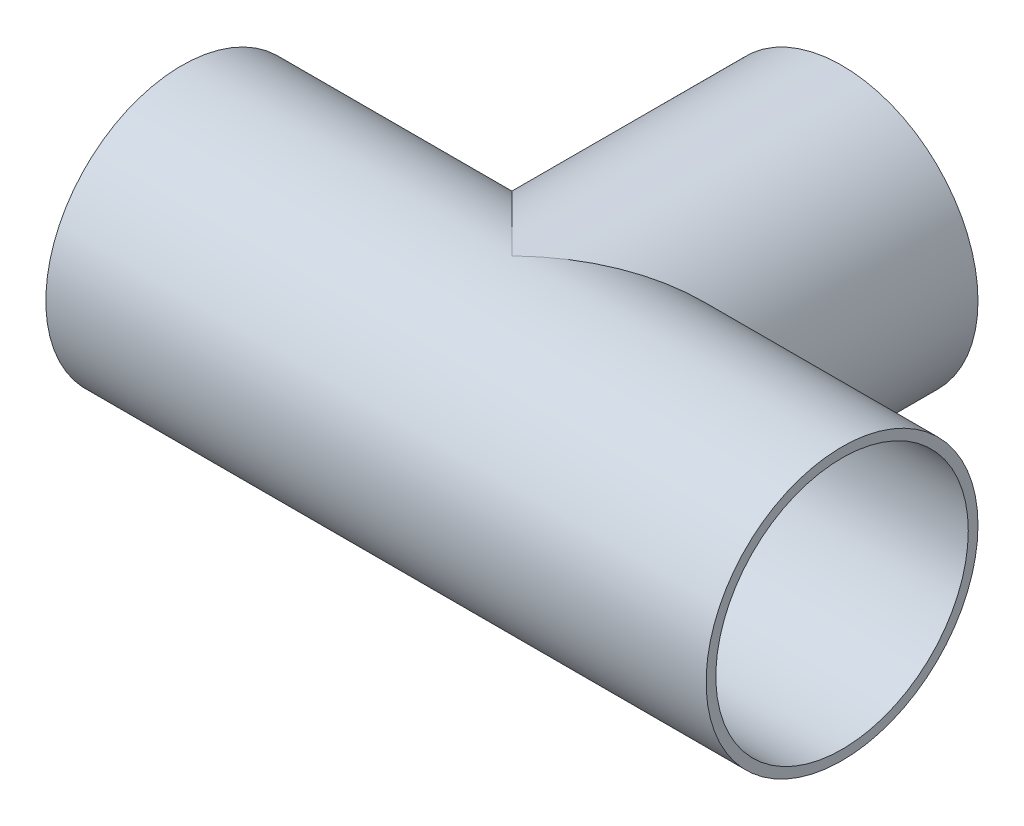
from build123d import *

# Parameters (mm, degrees)
SKETCH1_R           = 35
BOSS_EXTRUDE1_DEPTH = 170
SKETCH4_R           = 35
BOSS_EXTRUDE2_DEPTH = 85
SKETCH5_R           = 32.5
CUT_EXTRUDE2_DEPTH  = 85
SKETCH2_R           = 32.5
CUT_EXTRUDE3_DEPTH  = 194.261480901


with BuildPart() as part:
    # Sketch1 → Boss-Extrude1 (new body)
    with BuildSketch(Plane(origin=(0, 0, 0), x_dir=(0, 0, -1), z_dir=(1, 0, 0))):
        Circle(SKETCH1_R)
    extrude(amount=-BOSS_EXTRUDE1_DEPTH)

    # Sketch4 → Boss-Extrude2 (add)
    with BuildSketch(Plane.XY):
        with Locations((-85, 0)):
            Circle(SKETCH4_R)
    extrude(amount=-BOSS_EXTRUDE2_DEPTH)

    # Sketch5 → Cut-Extrude2 (cut)
    with BuildSketch(Plane(origin=(0, 0, -85), x_dir=(-1, 0, 0), z_dir=(0, 0, -1))):
        with Locations((85, 0)):
            Circle(SKETCH5_R)
    extrude(amount=-CUT_EXTRUDE2_DEPTH, mode=Mode.SUBTRACT)

    # Sketch2 → Cut-Extrude3 (cut, through all)
    with BuildSketch(Plane(origin=(0, 0, 0), x_dir=(0, 0, -1), z_dir=(1, 0, 0))):
        Circle(SKETCH2_R)
    extrude(amount=-CUT_EXTRUDE3_DEPTH, mode=Mode.SUBTRACT)


solid = part.part
